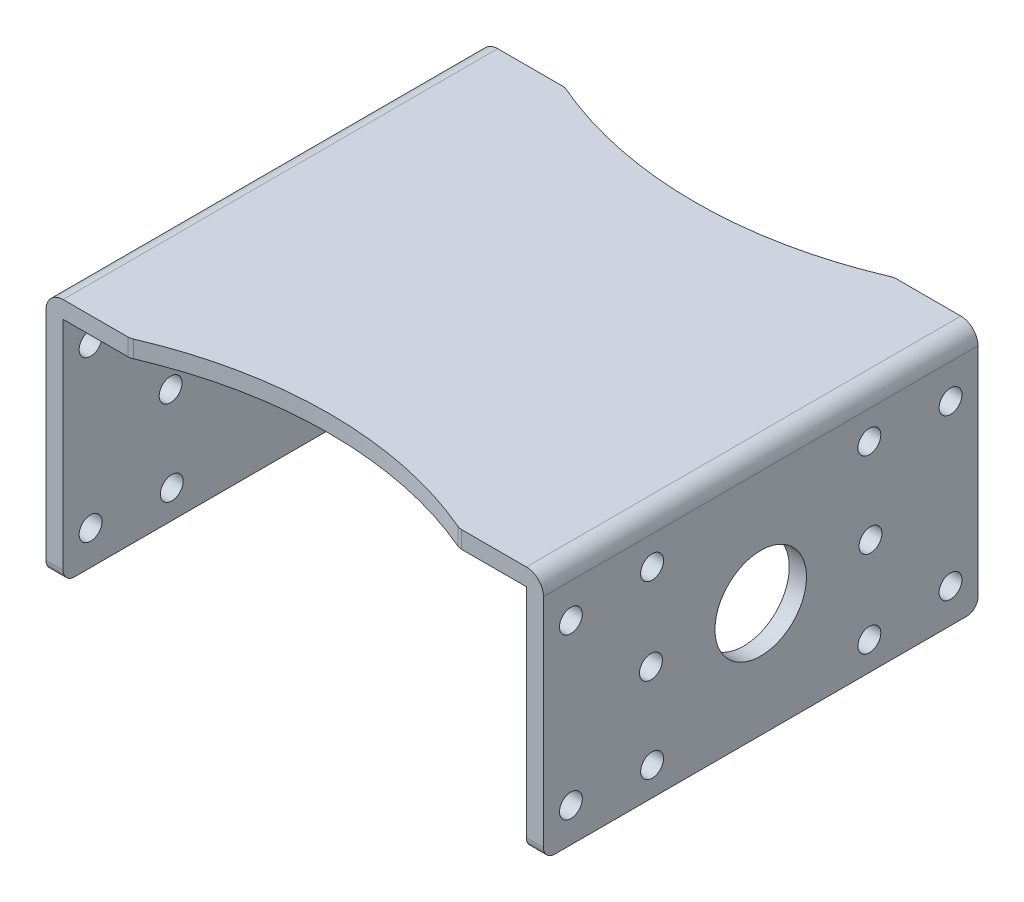
from build123d import *

# Parameters (mm, degrees)
SKETCH_1_W                = 43.5
SKETCH_1_H                = 38
EXTRUDE_1_DEPTH           = 21.5
SKETCH_2_W                = 40.5
SKETCH_2_H                = 20
CUT_EXTRUDE_1_DEPTH       = 49.135875395
CUT_EXTRUDE_2_DEPTH       = 37.004340016
CUT_EXTRUDE_3_DEPTH       = 37.004340016
HOLE_WIZARD_8_0_8_1_D     = 8
HOLE_WIZARD_8_0_8_1_DEPTH = 1.5
HOLE_WIZARD_2_0_2_1_D     = 2
HOLE_WIZARD_2_0_2_1_DEPTH = 1.5
HOLE_WIZARD_8_0_8_2_D     = 8
HOLE_WIZARD_2_0_2_2_D     = 2
FILLET_1_R                = 1
FILLET_2_R                = 1.5


with BuildPart() as part:
    # 草图1 → 凸台-拉伸1 (new body)
    with BuildSketch(Plane.XZ.offset(20)):
        Rectangle(SKETCH_1_W, SKETCH_1_H)
    extrude(amount=-EXTRUDE_1_DEPTH)

    # 草图2 → 切除-拉伸1 (cut, through all)
    with BuildSketch(Plane.XY.offset(19)):
        with Locations((0, -10)):
            Rectangle(SKETCH_2_W, SKETCH_2_H)
    extrude(amount=-CUT_EXTRUDE_1_DEPTH, mode=Mode.SUBTRACT)

    # 草图3 → 切除-拉伸2 (cut, through all)
    with BuildSketch(Plane(origin=(0, 1.5, 0), x_dir=(-1, 0, 0), z_dir=(0, 1, 0))):
        with BuildLine():
            Line((14.38749457, 19), (-14.38749457, 19))
            ThreePointArc((-14.38749457, 19), (0, 16), (14.38749457, 19))
        make_face()
    extrude(amount=-CUT_EXTRUDE_2_DEPTH, mode=Mode.SUBTRACT)

    # 草图4 → 切除-拉伸3 (cut, through all)
    with BuildSketch(Plane(origin=(0, 1.5, 0), x_dir=(-1, 0, 0), z_dir=(0, 1, 0))):
        with BuildLine():
            Line((-14.38749457, -19), (14.38749457, -19))
            ThreePointArc((14.38749457, -19), (0, -16), (-14.38749457, -19))
        make_face()
    extrude(amount=-CUT_EXTRUDE_3_DEPTH, mode=Mode.SUBTRACT)

    # Ø8.0 (8) 直径孔1
    with Locations(Plane.ZY.offset(-20.25)):
        with Locations((0, -10)):
            Hole(HOLE_WIZARD_8_0_8_1_D / 2, depth=HOLE_WIZARD_8_0_8_1_DEPTH)

    # Ø2.0 (2) 直径孔1
    with Locations(Plane.ZY.offset(-20.25)):
        with Locations((16.6, -3), (16.6, -17), (9.5, -17.5), (9.6, -10), (9.5, -2.5), (-9.5, -2.5), (-16.6, -3), (-16.6, -17), (-9.5, -17.5), (-9.6, -10)):
            Hole(HOLE_WIZARD_2_0_2_1_D / 2, depth=HOLE_WIZARD_2_0_2_1_DEPTH)

    # Ø8.0 (8) 直径孔2 (through all)
    with Locations(Plane(origin=(-20.25, 0, 0), x_dir=(0, 0, -1), z_dir=(1, 0, 0))):
        with Locations((0, -10)):
            Hole(HOLE_WIZARD_8_0_8_2_D / 2)

    # Ø2.0 (2) 直径孔2 (through all)
    with Locations(Plane(origin=(-20.25, 0, 0), x_dir=(0, 0, -1), z_dir=(1, 0, 0))):
        with Locations((-16.6, -3), (-16.6, -17), (-9.5, -17.5), (-9.6, -10), (-9.5, -2.5), (9.5, -2.5), (16.6, -3), (16.6, -17), (9.5, -17.5), (9.6, -10)):
            Hole(HOLE_WIZARD_2_0_2_2_D / 2)

    # 圆角1
    fillet_1_edges = [part.edges().sort_by_distance(p)[0] for p in [
        (-21, -20, 19),
        (21, -20, -19),
        (-14.38749457, 0.75, 19),
        (14.38749457, 0.75, 19),
        (14.38749457, 0.75, -19),
        (-14.38749457, 0.75, -19),
        (-21, -20, -19),
        (21, -20, 19),
    ]]
    fillet(fillet_1_edges, radius=FILLET_1_R)

    # 圆角2
    fillet_2_edges = [part.edges().sort_by_distance(p)[0] for p in [
        (-21.75, 1.5, 0),
        (21.75, 1.5, 0),
    ]]
    fillet(fillet_2_edges, radius=FILLET_2_R)


solid = part.part
